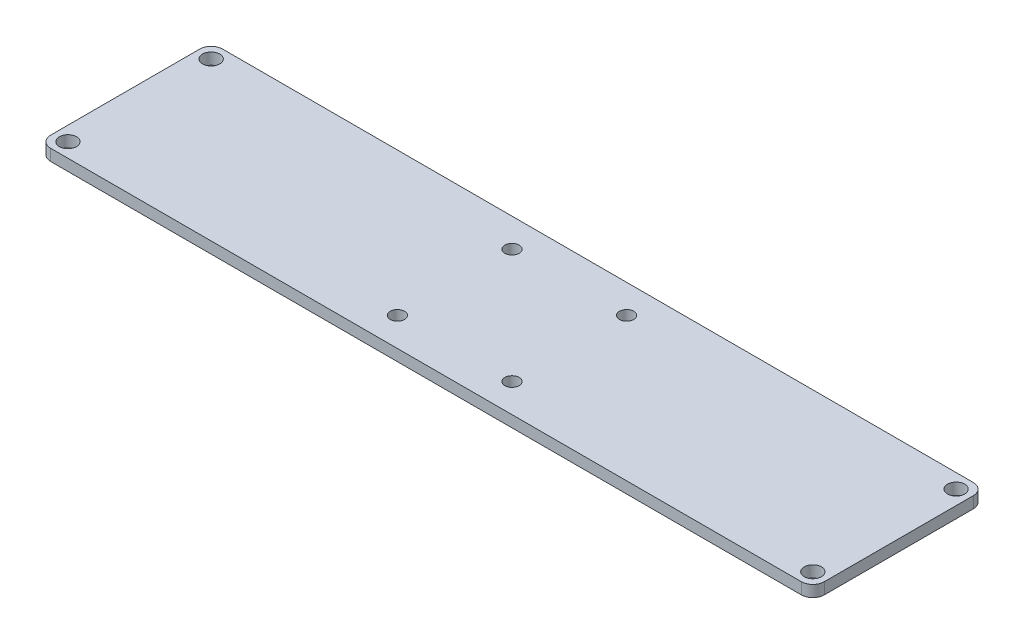
from build123d import *

# Parameters (mm, degrees)
SKETCH_1_W          = 135
SKETCH_1_H          = 30
SKETCH_1_R          = 1.5
EXTRUDE_1_DEPTH     = 2
FILLET_1_R          = 2
SKETCH_2_R          = 1.25
CUT_EXTRUDE_1_DEPTH = 2


with BuildPart() as part:
    # 草图1 → 凸台-拉伸1 (new body)
    with BuildSketch(Plane(origin=(0, 0, 0), x_dir=(1, 0, 0), z_dir=(0, 1, 0))):
        with Locations((11.415492739, 2.058344197)):
            Rectangle(SKETCH_1_W, SKETCH_1_H)
        with Locations(Location((-53.584507261, 14.558344197, 0), (0, 0, 270))):
            Circle(SKETCH_1_R, mode=Mode.SUBTRACT)
        with Locations(Location((-53.584507261, -10.441655803, 0), (0, 0, 270))):
            Circle(SKETCH_1_R, mode=Mode.SUBTRACT)
        with Locations(Location((76.415492739, 14.558344197, 0), (0, 0, 270))):
            Circle(SKETCH_1_R, mode=Mode.SUBTRACT)
        with Locations(Location((76.415492739, -10.441655803, 0), (0, 0, 270))):
            Circle(SKETCH_1_R, mode=Mode.SUBTRACT)
    extrude(amount=EXTRUDE_1_DEPTH)

    # 圆角1
    fillet_1_edges = [part.edges().sort_by_distance(p)[0] for p in [
        (-56.084507261, 1, -17.058344197),
        (78.915492739, 1, -17.058344197),
        (78.915492739, 1, 12.941655803),
        (-56.084507261, 1, 12.941655803),
    ]]
    fillet(fillet_1_edges, radius=FILLET_1_R)

    # 草图2 → 切除-拉伸1 (cut)
    with BuildSketch(Plane.XZ):
        with Locations(Location((1.415492739, 7.941655803, 0), (0, 0, 270))):
            Circle(SKETCH_2_R)
        with Locations(Location((21.415492739, 7.941655803, 0), (0, 0, 270))):
            Circle(SKETCH_2_R)
        with Locations(Location((1.415492739, -12.058344197, 0), (0, 0, 270))):
            Circle(SKETCH_2_R)
        with Locations(Location((21.415492739, -12.058344197, 0), (0, 0, 270))):
            Circle(SKETCH_2_R)
    extrude(amount=-CUT_EXTRUDE_1_DEPTH, mode=Mode.SUBTRACT)


solid = part.part
